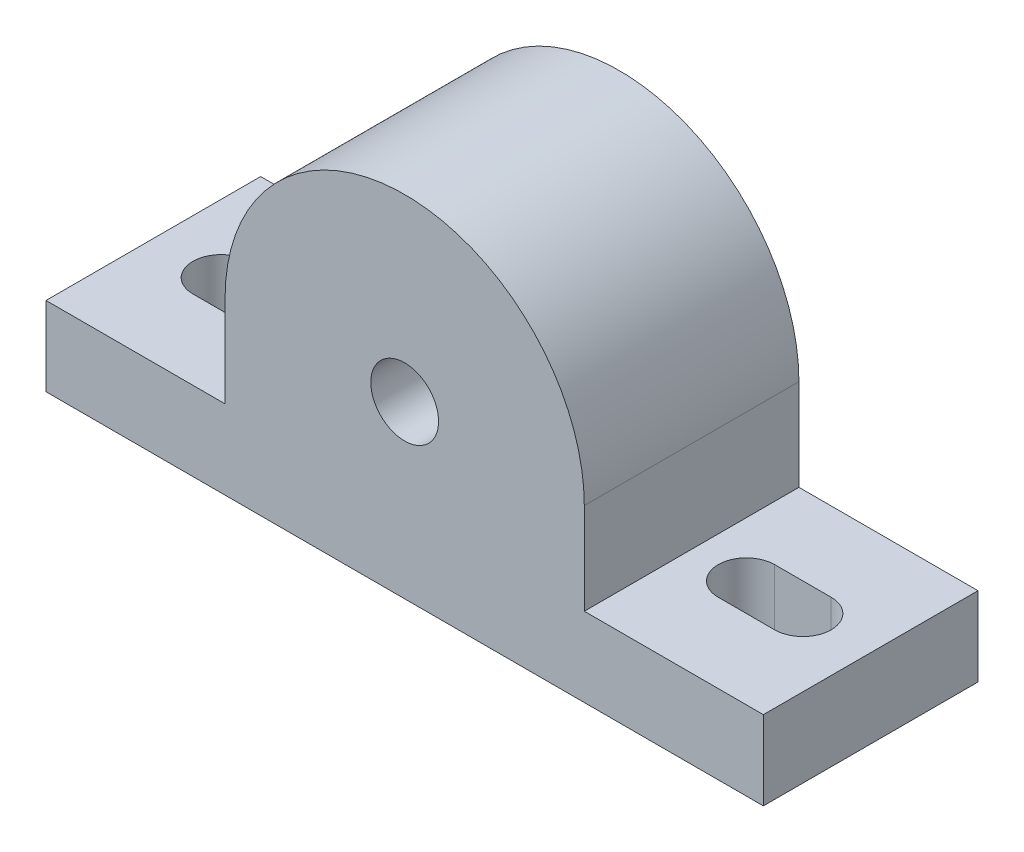
from build123d import *

# Parameters (mm, degrees)
SKETCH_1_R          = 6
EXTRUDE_1_DEPTH     = 19
CUT_EXTRUDE_1_DEPTH = 82.836727696


with BuildPart() as part:
    # Эскиз1 → Бобышка-Вытянуть1 (new, symmetric)
    with BuildSketch(Plane.XY):
        with BuildLine():
            Line((-31.8, 0), (-31.8, 16.2))
            ThreePointArc((-31.8, 16.2), (0, 48), (31.8, 16.2))
            Line((31.8, 16.2), (31.8, 0))
            Line((31.8, 0), (63.5, 0))
            Line((63.5, 0), (63.5, -14))
            Line((63.5, -14), (-63.5, -14))
            Line((-63.5, -14), (-63.5, 0))
            Line((-63.5, 0), (-31.8, 0))
        make_face()
        with Locations(Location((0, 16.2, 0), (0, 0, 180))):
            Circle(SKETCH_1_R, mode=Mode.SUBTRACT)
    extrude(amount=EXTRUDE_1_DEPTH, both=True)

    # Эскиз2 → Вырез-Вытянуть1 (cut, through all)
    with BuildSketch(Plane(origin=(0, 0, 0), x_dir=(1, 0, 0), z_dir=(0, 1, 0))):
        with BuildLine():
            Line((-51.5, 5), (-41.5, 5))
            ThreePointArc((-41.5, 5), (-36.5, 0), (-41.5, -5))
            Line((-41.5, -5), (-51.5, -5))
            ThreePointArc((-51.5, -5), (-56.5, 0), (-51.5, 5))
        make_face()
        with BuildLine():
            Line((51.5, 5), (41.5, 5))
            ThreePointArc((41.5, 5), (36.5, 0), (41.5, -5))
            Line((41.5, -5), (51.5, -5))
            ThreePointArc((51.5, -5), (56.5, 0), (51.5, 5))
        make_face()
    extrude(amount=-CUT_EXTRUDE_1_DEPTH, mode=Mode.SUBTRACT)


solid = part.part
